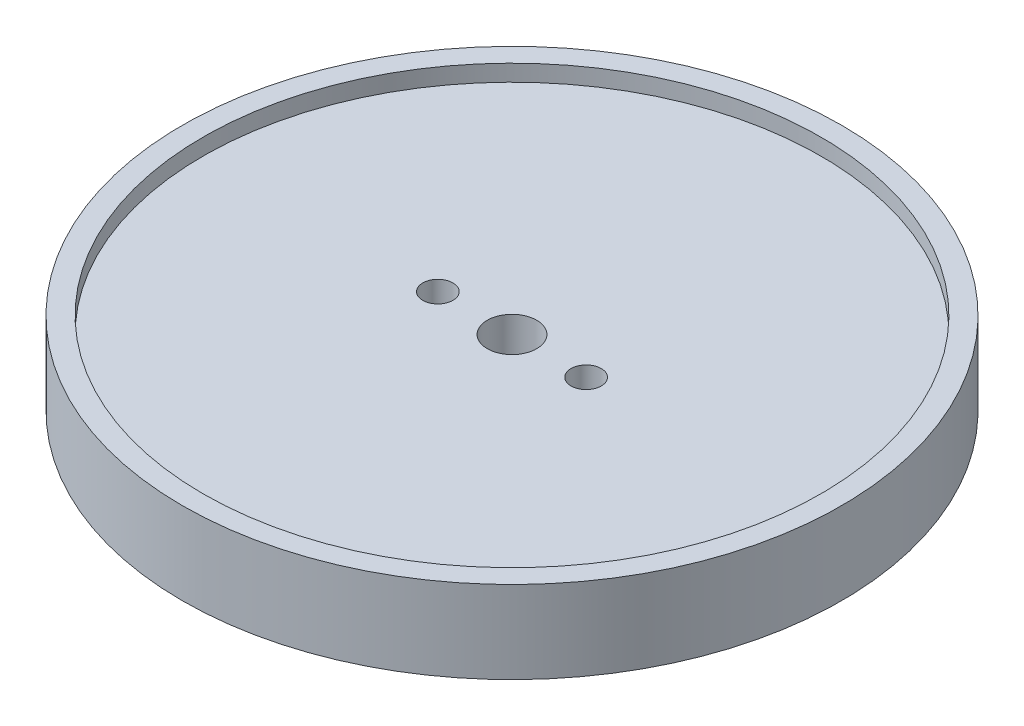
from build123d import *

# Parameters (mm, degrees)
SKETCH2_R           = 40
SKETCH2_R_2         = 37.5
BOSS_EXTRUDE1_DEPTH = 10
SKETCH2_4_R         = 37.5
SKETCH2_4_R_2       = 1.835
SKETCH2_4_R_3       = 3
BOSS_EXTRUDE2_DEPTH = 8


with BuildPart() as part:
    # Sketch2 → Boss-Extrude1 (new body)
    with BuildSketch(Plane(origin=(0, 0, 0), x_dir=(1, 0, 0), z_dir=(0, 1, 0))):
        Circle(SKETCH2_R)
        Circle(SKETCH2_R_2, mode=Mode.SUBTRACT)
    extrude(amount=BOSS_EXTRUDE1_DEPTH)

    # Sketch2<4> → Boss-Extrude2 (add)
    with BuildSketch(Plane(origin=(0, 0, 0), x_dir=(1, 0, 0), z_dir=(0, 1, 0))):
        Circle(SKETCH2_4_R)
        with Locations((-9, 0)):
            Circle(SKETCH2_4_R_2, mode=Mode.SUBTRACT)
        Circle(SKETCH2_4_R_3, mode=Mode.SUBTRACT)
        with Locations((9, 0)):
            Circle(SKETCH2_4_R_2, mode=Mode.SUBTRACT)
    extrude(amount=BOSS_EXTRUDE2_DEPTH)


solid = part.part
